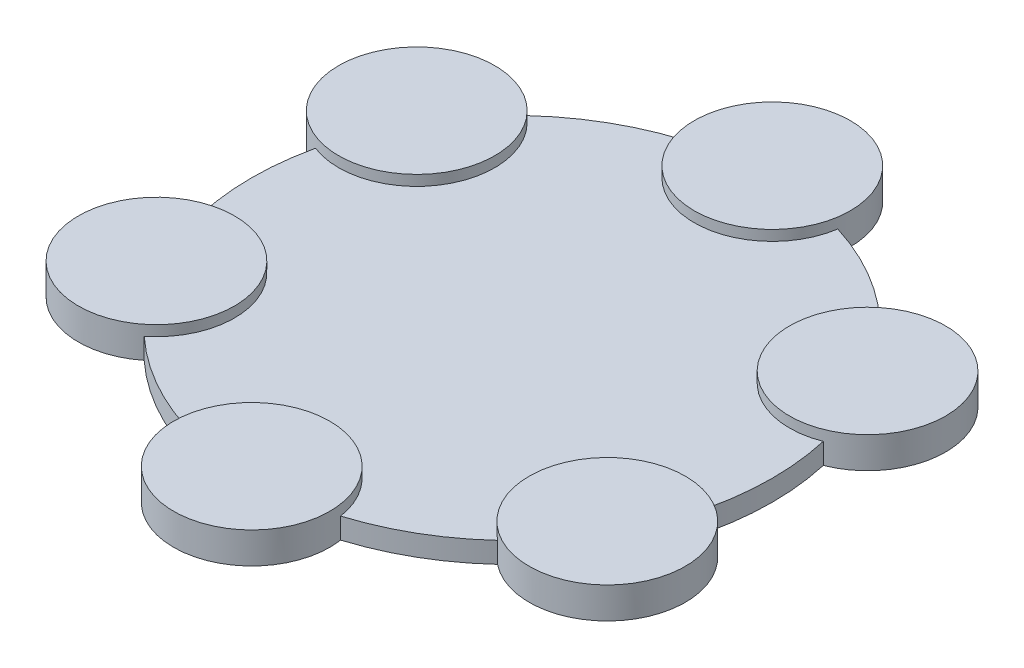
from build123d import *

# Parameters (mm, degrees)
ESQUISSE2_R                  = 250
BOSS_EXTRU_2_DEPTH           = 20
ESQUISSE3_R                  = 75
BOSS_EXTRU_3_DEPTH           = 30
R_P_TITION_CIRCULAIRE1_COUNT = 6


with BuildPart() as part:
    # Esquisse2 → Boss.-Extru.2 (new body)
    with BuildSketch(Plane(origin=(0, 0, 0), x_dir=(1, 0, 0), z_dir=(0, 1, 0))):
        with Locations(Location((0, 0, 0), (0, 0, 270))):
            Circle(ESQUISSE2_R)
    extrude(amount=BOSS_EXTRU_2_DEPTH)

    # Esquisse3 → Boss.-Extru.3 (add)
    with BuildSketch(Plane.XZ):
        with Locations(Location((0, 250, 0), (0, 0, 270))):
            Circle(ESQUISSE3_R)
    boss_extru_3 = extrude(amount=-BOSS_EXTRU_3_DEPTH)

    # Répétition circulaire1: Boss.-Extru.3 ×6 about axis
    r_p_tition_circulaire1_axis = Axis((0, 0, 0), (0, 1, 0))
    for i in range(1, R_P_TITION_CIRCULAIRE1_COUNT):
        add(boss_extru_3.rotate(r_p_tition_circulaire1_axis, i * 360 / R_P_TITION_CIRCULAIRE1_COUNT))


solid = part.part
